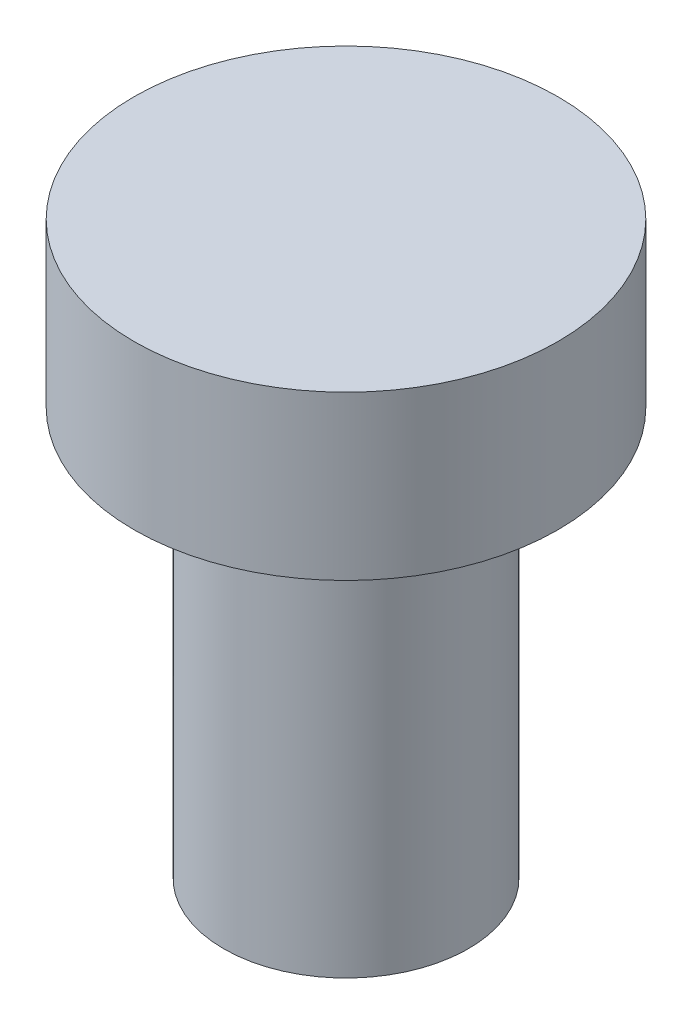
from build123d import *

# Parameters (mm, degrees)
SKETCH1_R           = 1.5
BOSS_EXTRUDE1_DEPTH = 5
SKETCH3_R           = 2.6
BOSS_EXTRUDE2_DEPTH = 2


with BuildPart() as part:
    # Sketch1 → Boss-Extrude1 (new body)
    with BuildSketch(Plane(origin=(0, 0, 0), x_dir=(1, 0, 0), z_dir=(0, 1, 0))):
        with Locations(Location((0, 0, 0), (0, 0, 270))):
            Circle(SKETCH1_R)
    extrude(amount=BOSS_EXTRUDE1_DEPTH)

    # Sketch3 → Boss-Extrude2 (add)
    with BuildSketch(Plane(origin=(0, 5, 0), x_dir=(1, 0, 0), z_dir=(0, 1, 0))):
        with Locations(Location((0, 0, 0), (0, 0, 270))):
            Circle(SKETCH3_R)
    extrude(amount=BOSS_EXTRUDE2_DEPTH)


solid = part.part
